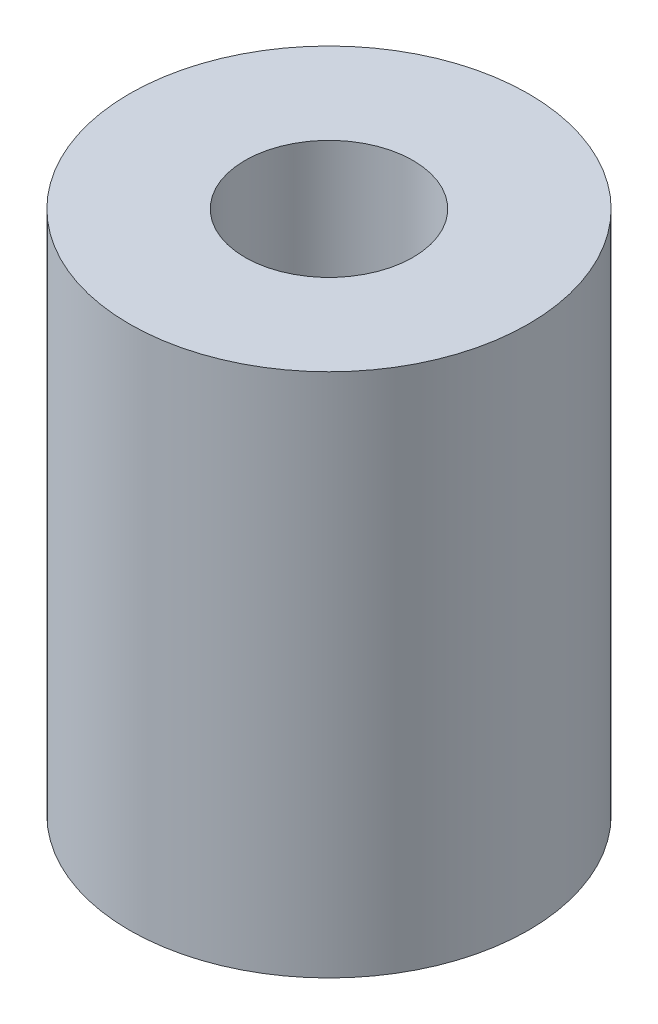
from build123d import *

# Parameters (mm, degrees)
SKETCH1_R           = 9.5
BOSS_EXTRUDE1_DEPTH = 25
SKETCH2_R           = 4
CUT_EXTRUDE1_DEPTH  = 12.5
SKETCH3_R           = 2.5
CUT_EXTRUDE2_DEPTH  = 12.5


with BuildPart() as part:
    # Sketch1 → Boss-Extrude1 (new body)
    with BuildSketch(Plane(origin=(0, 0, 0), x_dir=(1, 0, 0), z_dir=(0, 1, 0))):
        with Locations(Location((0, 0, 0), (0, 0, 270))):
            Circle(SKETCH1_R)
    extrude(amount=BOSS_EXTRUDE1_DEPTH)

    # Sketch2 → Cut-Extrude1 (cut)
    with BuildSketch(Plane(origin=(0, 25, 0), x_dir=(1, 0, 0), z_dir=(0, 1, 0))):
        with Locations(Location((0, 0, 0), (0, 0, 270))):
            Circle(SKETCH2_R)
    extrude(amount=-CUT_EXTRUDE1_DEPTH, mode=Mode.SUBTRACT)

    # Sketch3 → Cut-Extrude2 (cut)
    with BuildSketch(Plane.XZ):
        with Locations(Location((0, 0, 0), (0, 0, 270))):
            Circle(SKETCH3_R)
    extrude(amount=-CUT_EXTRUDE2_DEPTH, mode=Mode.SUBTRACT)


solid = part.part
